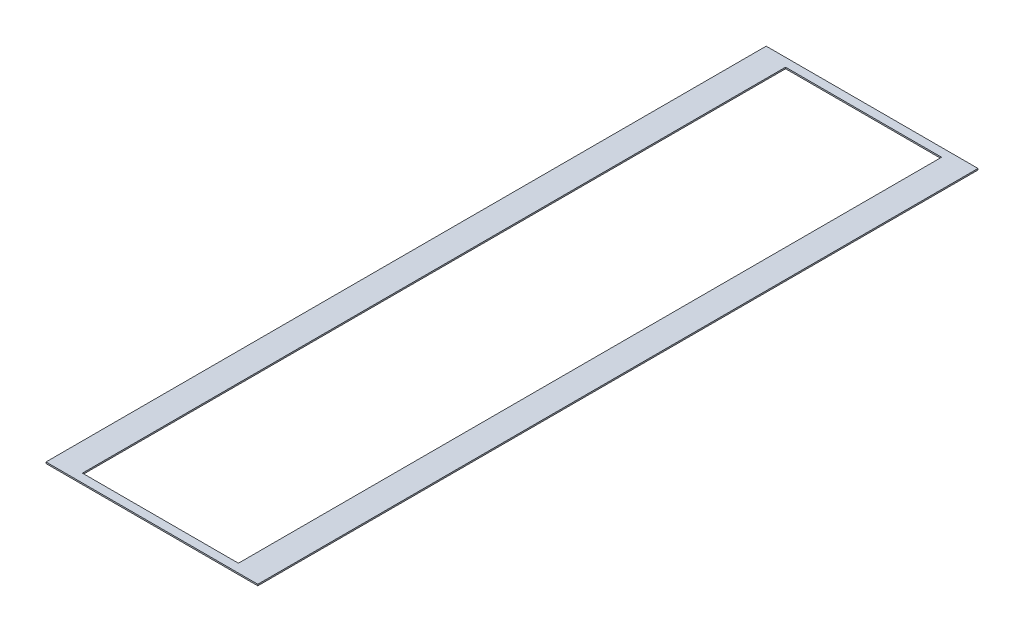
from build123d import *

# Parameters (mm, degrees)
SKETCH1_W           = 150
SKETCH1_H           = 510
BOSS_EXTRUDE1_DEPTH = 1
SKETCH2_W           = 110.470112176
SKETCH2_H           = 497.951467828
CUT_EXTRUDE1_DEPTH  = 1


with BuildPart() as part:
    # Sketch1 → Boss-Extrude1 (new body)
    with BuildSketch(Plane(origin=(0, 0, 0), x_dir=(1, 0, 0), z_dir=(0, 1, 0))):
        Rectangle(SKETCH1_W, SKETCH1_H)
    extrude(amount=BOSS_EXTRUDE1_DEPTH)

    # Sketch2 → Cut-Extrude1 (cut)
    with BuildSketch(Plane(origin=(0, 1, 0), x_dir=(1, 0, 0), z_dir=(0, 1, 0))):
        Rectangle(SKETCH2_W, SKETCH2_H)
    extrude(amount=-CUT_EXTRUDE1_DEPTH, mode=Mode.SUBTRACT)


solid = part.part
